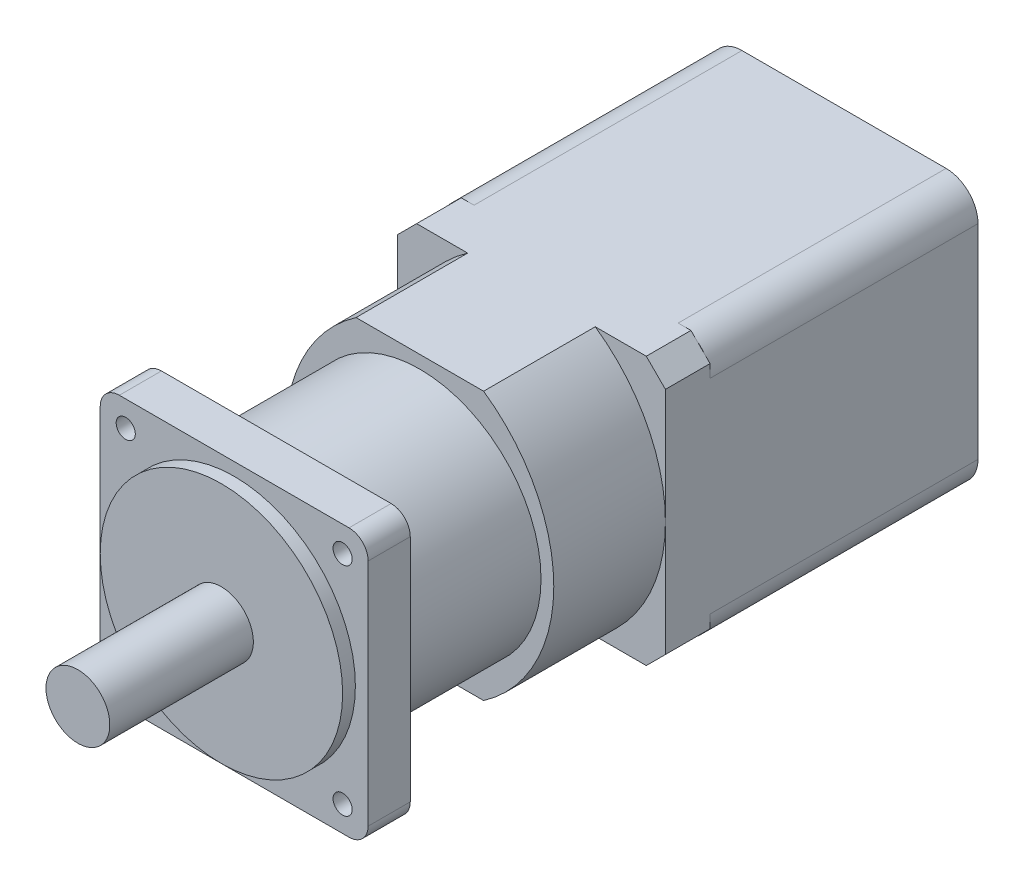
from build123d import *

# Parameters (mm, degrees)
EXTRUDE_1_DEPTH = 42
EXTRUDE_2_DEPTH = 7
EXTRUDE_3_DEPTH = 17.5
SKETCH_4_R      = 19
EXTRUDE_4_DEPTH = 22.5
SKETCH_5_R      = 1.5
EXTRUDE_5_DEPTH = 6.6
SKETCH_6_R      = 19
EXTRUDE_6_DEPTH = 2
SKETCH_7_R      = 5
EXTRUDE_7_DEPTH = 22.5


with BuildPart() as part:
    # 草图1 → 凸台-拉伸1 (new body)
    with BuildSketch(Plane.XY):
        with BuildLine():
            Line((-16, 21), (16, 21))
            ThreePointArc((16, 21), (19.535533906, 19.535533906), (21, 16))
            Line((21, 16), (21, -16))
            ThreePointArc((21, -16), (19.535533906, -19.535533906), (16, -21))
            Line((16, -21), (-16, -21))
            ThreePointArc((-16, -21), (-19.535533906, -19.535533906), (-21, -16))
            Line((-21, -16), (-21, 16))
            ThreePointArc((-21, 16), (-19.535533906, 19.535533906), (-16, 21))
        make_face()
    extrude(amount=EXTRUDE_1_DEPTH)

    # 草图2 → 凸台-拉伸2 (add)
    with BuildSketch(Plane.XY.offset(42)):
        Polygon((18, 21), (-18, 21), (-21, 18), (-21, -18), (-18, -21), (18, -21), (21, -18), (21, 18), align=None)
    extrude(amount=EXTRUDE_2_DEPTH)

    # 草图3 → 凸台-拉伸3 (add)
    with BuildSketch(Plane.XY.offset(49)):
        with BuildLine():
            Line((-10, 21), (10, 21))
            ThreePointArc((10, 21), (21, 0), (10, -21))
            Line((10, -21), (-10, -21))
            ThreePointArc((-10, -21), (-21, 0), (-10, 21))
        make_face()
    extrude(amount=EXTRUDE_3_DEPTH)

    # 草图4 → 凸台-拉伸4 (add)
    with BuildSketch(Plane.XY.offset(66.5)):
        with Locations(Location((0, 0, 0), (0, 0, 180))):
            Circle(SKETCH_4_R)
    extrude(amount=EXTRUDE_4_DEPTH)

    # 草图5 → 凸台-拉伸5 (add)
    with BuildSketch(Plane.XY.offset(89)):
        with BuildLine():
            Line((-18, 21), (18, 21))
            ThreePointArc((18, 21), (20.121320344, 20.121320344), (21, 18))
            Line((21, 18), (21, -18))
            ThreePointArc((21, -18), (20.121320344, -20.121320344), (18, -21))
            Line((18, -21), (-18, -21))
            ThreePointArc((-18, -21), (-20.121320344, -20.121320344), (-21, -18))
            Line((-21, -18), (-21, 18))
            ThreePointArc((-21, 18), (-20.121320344, 20.121320344), (-18, 21))
        make_face()
        with Locations((-17, 17)):
            Circle(SKETCH_5_R, mode=Mode.SUBTRACT)
        with Locations((17, 17)):
            Circle(SKETCH_5_R, mode=Mode.SUBTRACT)
        with Locations((17, -17)):
            Circle(SKETCH_5_R, mode=Mode.SUBTRACT)
        with Locations((-17, -17)):
            Circle(SKETCH_5_R, mode=Mode.SUBTRACT)
    extrude(amount=EXTRUDE_5_DEPTH)

    # 草图6 → 凸台-拉伸6 (add)
    with BuildSketch(Plane.XY.offset(95.6)):
        with Locations(Location((0, 0, 0), (0, 0, 180))):
            Circle(SKETCH_6_R)
    extrude(amount=EXTRUDE_6_DEPTH)

    # 草图7 → 凸台-拉伸7 (add)
    with BuildSketch(Plane.XY.offset(97.6)):
        with Locations(Location((0, 0, 0), (0, 0, 180))):
            Circle(SKETCH_7_R)
    extrude(amount=EXTRUDE_7_DEPTH)


solid = part.part
